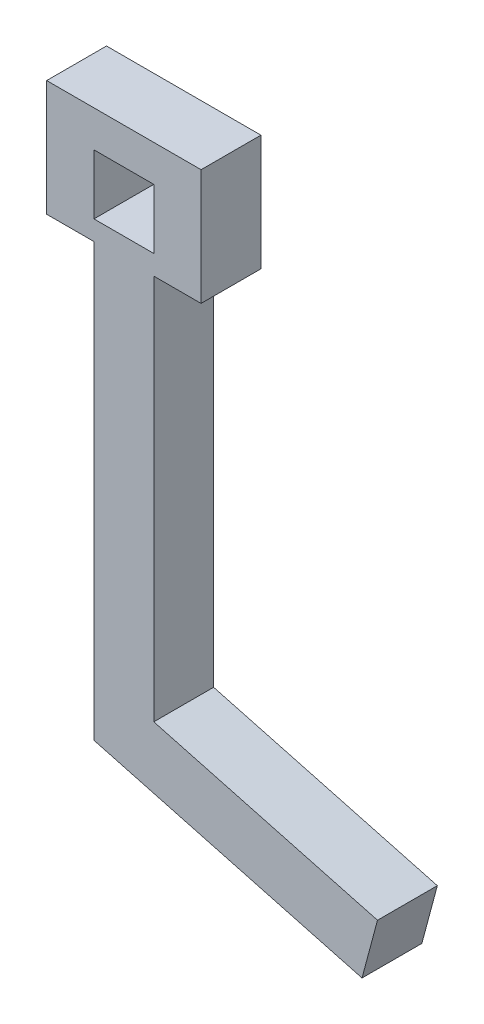
from build123d import *

# Parameters (mm, degrees)
SKETCH_1_W      = 15.5
SKETCH_1_H      = 15.5
EXTRUDE_1_DEPTH = 15.5


with BuildPart() as part:
    # 草图1 → 凸台-拉伸1 (new body)
    with BuildSketch(Plane.XY):
        Polygon((28.466671087, -18.917272271), (28.466671087, 92.976296042), (16.216671087, 92.976296042), (16.216671087, 122.976296042), (56.216671087, 122.976296042), (56.216671087, 92.976296042), (43.966671087, 92.976296042), (43.966671087, -7.023703958), (101.922220665, -22.552846664), (97.910525465, -37.524696971), align=None)
        with Locations((36.216671087, 105.808330351)):
            Rectangle(SKETCH_1_W, SKETCH_1_H, mode=Mode.SUBTRACT)
    extrude(amount=EXTRUDE_1_DEPTH)


solid = part.part
